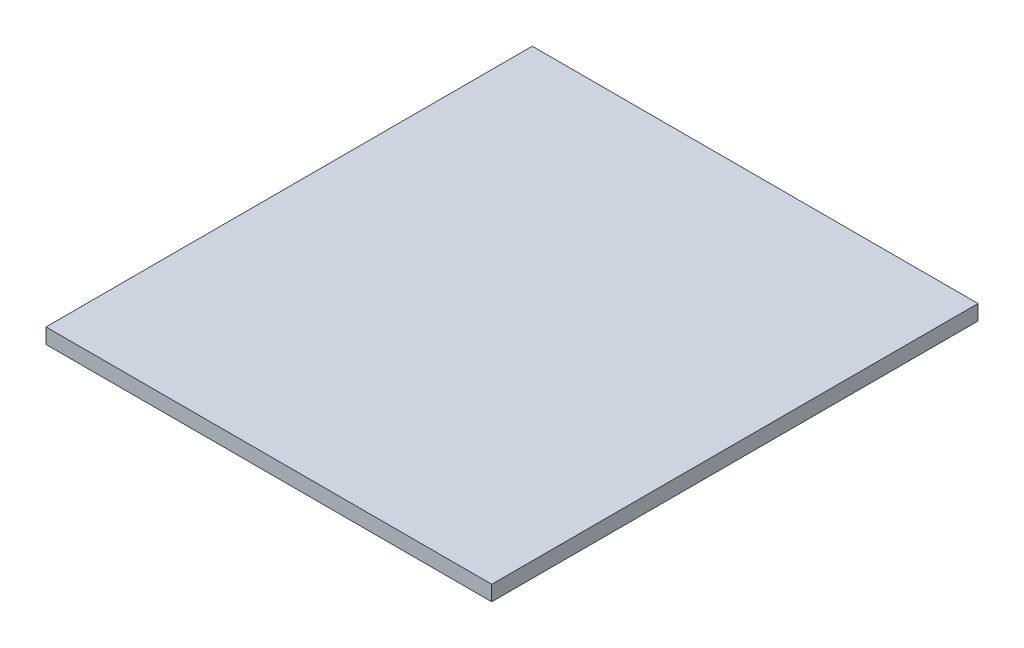
from build123d import *

# Parameters (mm, degrees)
SKETCH1_W           = 279.4
SKETCH1_H           = 304.8
BOSS_EXTRUDE1_DEPTH = 9.525


with BuildPart() as part:
    # Sketch1 → Boss-Extrude1 (new body)
    with BuildSketch(Plane.XZ.offset(127)):
        with Locations((-128.65, -38.1)):
            Rectangle(SKETCH1_W, SKETCH1_H)
    extrude(amount=BOSS_EXTRUDE1_DEPTH)


solid = part.part
